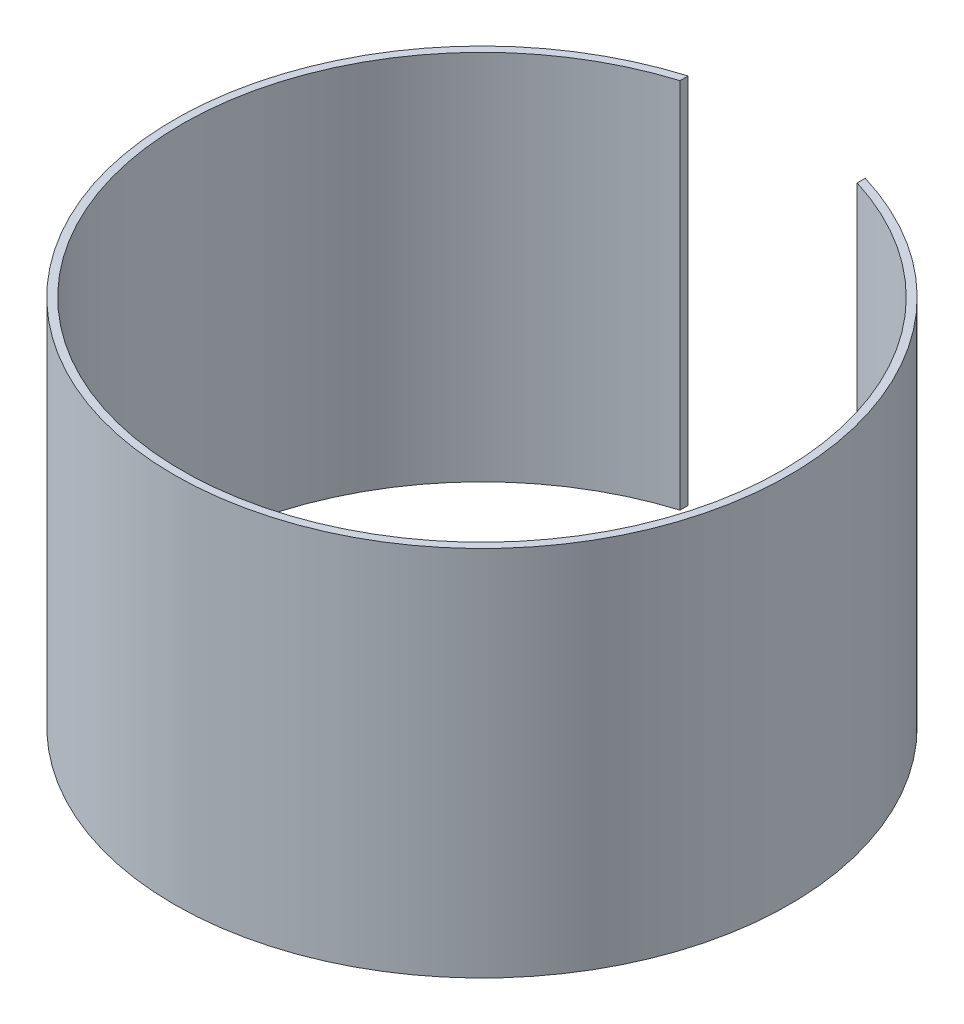
from build123d import *

# Parameters (mm, degrees)
SKETCH1_R           = 40.538
SKETCH1_R_2         = 39.522
BOSS_EXTRUDE1_DEPTH = 49
CUT_EXTRUDE1_DEPTH  = 48


with BuildPart() as part:
    # Sketch1 → Boss-Extrude1 (new body)
    with BuildSketch(Plane(origin=(0, 0, 0), x_dir=(0.9999530758491465, 0, -0.009687419668383268), z_dir=(0, 1, 0))):
        with Locations(Location((-29.391570254, 2.611368154, 0), (0, 0, 269.444943057))):
            Circle(SKETCH1_R)
        with Locations(Location((-29.391570254, 2.611368154, 0), (0, 0, 269.444943057))):
            Circle(SKETCH1_R_2, mode=Mode.SUBTRACT)
    extrude(amount=BOSS_EXTRUDE1_DEPTH)

    # Sketch2 → Cut-Extrude1 (cut)
    with BuildSketch(Plane.XY):
        Polygon((-17.749488499, 19.5), (-17.749488499, 49), (-41.081488499, 49), (-41.081488499, 0), (-17.749488499, 0), align=None)
    extrude(amount=-CUT_EXTRUDE1_DEPTH, mode=Mode.SUBTRACT)


solid = part.part
